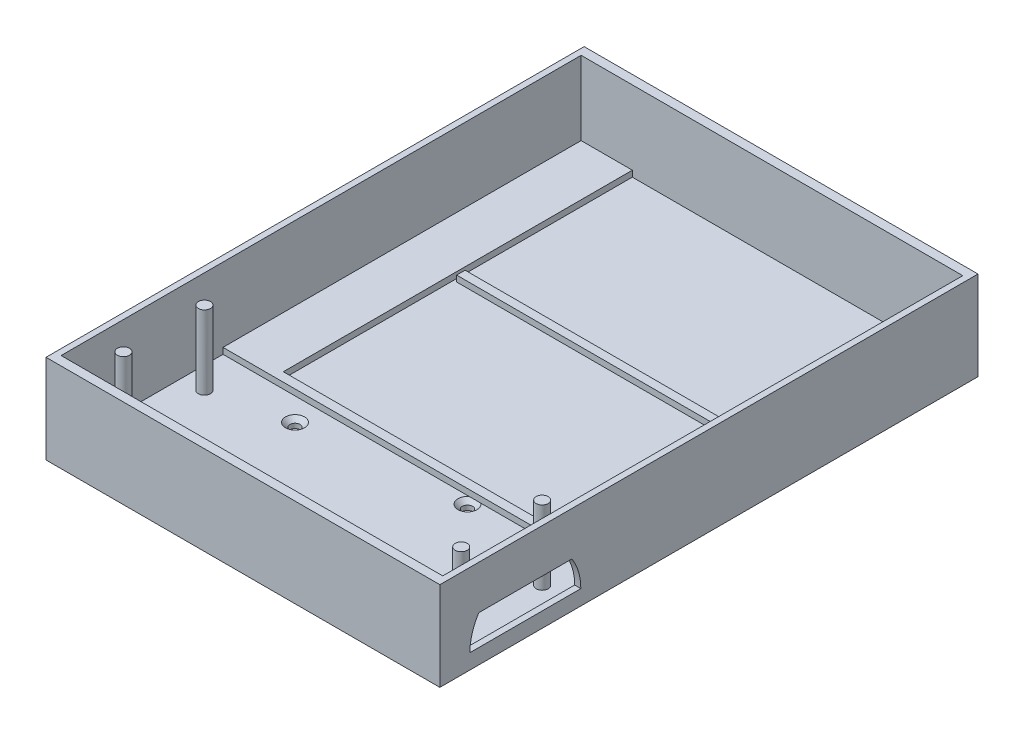
from build123d import *

# Parameters (mm, degrees)
SKETCH1_W                                    = 130.62
SKETCH1_H                                    = 3
SKETCH1_W_2                                  = 18.99
SKETCH1_W_3                                  = 25.43
SKETCH1_W_4                                  = 84.2
SKETCH1_H_2                                  = 2.79860344
BOSS_EXTRUDE1_DEPTH                          = 2
SKETCH2_W                                    = 130.62
SKETCH2_H                                    = 178.45860344
BOSS_EXTRUDE2_DEPTH                          = 3
CSK_FOR_M3_COUNTERSUNK_FLAT_HEAD_SCR_2_COUNT = 2
CSK_FOR_M3_COUNTERSUNK_FLAT_HEAD_SCR_2_PITCH = 53.025276991
CSK_FOR_M3_COUNTERSUNK_FLAT_HEAD_SCR_3_COUNT = 2
CSK_FOR_M3_COUNTERSUNK_FLAT_HEAD_SCR_3_PITCH = 66.620192134
CSK_FOR_M3_COUNTERSUNK_FLAT_HEAD_SCR_4_COUNT = 2
CSK_FOR_M3_COUNTERSUNK_FLAT_HEAD_SCR_4_PITCH = 48.217527933
SKETCH9_W                                    = 2.047760895
SKETCH9_H                                    = 53.7
SKETCH9_W_2                                  = 2
BOSS_EXTRUDE3_DEPTH                          = 24
SKETCH10_W                                   = 130.62
SKETCH10_H                                   = 3
BOSS_EXTRUDE4_DEPTH                          = 22
CUT_EXTRUDE1_DEPTH                           = 22
BOSS_EXTRUDE5_DEPTH                          = 22
SKETCH13_R                                   = 2
BOSS_EXTRUDE6_DEPTH                          = 24.5
SKETCH15_W                                   = 126.572239105
SKETCH15_H                                   = 3
SKETCH15_W_2                                 = 2
SKETCH15_H_2                                 = 172.45860344
SKETCH15_W_3                                 = 2.047760895
BOSS_EXTRUDE7_DEPTH                          = 2.5


with BuildPart() as part:
    # Sketch1 → Boss-Extrude1 (new body)
    with BuildSketch(Plane(origin=(0, 0, 0), x_dir=(1, 0, 0), z_dir=(0, 1, 0))):
        with Locations((69.266788991, -134.782980897)):
            Rectangle(SKETCH1_W, SKETCH1_H)
        with Locations((69.266788991, -78.082980897)):
            Rectangle(SKETCH1_W, SKETCH1_H)
        Polygon((134.576788991, -20.082980897), (109.146788991, -20.082980897), (109.146788991, -67.500327372), (109.146788991, -76.582980897), (134.576788991, -76.582980897), align=None)
        Polygon((22.946788991, -33.891997438), (22.946788991, -20.082980897), (3.956788991, -20.082980897), (3.956788991, -76.582980897), (22.946788991, -76.582980897), align=None)
        Polygon((22.946788991, -17.082980897), (22.946788991, 39.175622543), (6.956788991, 39.175622543), (3.956788991, 39.175622543), (3.956788991, -17.082980897), align=None)
        Polygon((131.576788991, 39.175622543), (109.146788991, 39.175622543), (109.146788991, -17.082980897), (134.576788991, -17.082980897), (134.576788991, 39.175622543), align=None)
        with Locations((13.451788991, -18.582980897)):
            Rectangle(SKETCH1_W_2, SKETCH1_H)
        with Locations((121.861788991, -18.582980897)):
            Rectangle(SKETCH1_W_3, SKETCH1_H)
        with Locations((66.046788991, -18.683679177)):
            Rectangle(SKETCH1_W_4, SKETCH1_H_2)
        Polygon((23.946788991, 39.175622543), (108.146788991, 39.175622543), (109.146788991, 39.175622543), (131.576788991, 39.175622543), (134.576788991, 39.175622543), (134.576788991, 42.175622543), (3.956788991, 42.175622543), (3.956788991, 39.175622543), (6.956788991, 39.175622543), (22.946788991, 39.175622543), align=None)
    extrude(amount=BOSS_EXTRUDE1_DEPTH)

    # Sketch2 → Boss-Extrude2 (add)
    with BuildSketch(Plane.XZ):
        with Locations((69.266788991, 47.053679177)):
            Rectangle(SKETCH2_W, SKETCH2_H)
    extrude(amount=BOSS_EXTRUDE2_DEPTH)

    # Sketch8 → CSK for M3 Countersunk Flat Head Screw1 (revolve, cut)
    with BuildSketch(Plane(origin=(88.234088991, 0, 130.282980897), x_dir=(0, 0, 1), z_dir=(1, 0, 0))):
        Polygon((0, 0), (0, 3), (1.7, 3), (1.7, 1.45), (3.15, 0), align=None)
    csk_for_m3_countersunk_flat_head_screw1 = revolve(axis=Axis((88.234088991, 6.35, 130.282980897), (0, -1, 0)), mode=Mode.SUBTRACT)

    # CSK for M3 Countersunk Flat Head Scr 2: CSK for M3 Countersunk Flat Head Screw1 ×2
    with Locations(*[Vector(-0.958033656445997, 0, -0.2866557397239995) * (i * CSK_FOR_M3_COUNTERSUNK_FLAT_HEAD_SCR_2_PITCH) for i in range(1, CSK_FOR_M3_COUNTERSUNK_FLAT_HEAD_SCR_2_COUNT)]):
        add(csk_for_m3_countersunk_flat_head_screw1, mode=Mode.SUBTRACT)

    # CSK for M3 Countersunk Flat Head Scr 3: CSK for M3 Countersunk Flat Head Screw1 ×2
    with Locations(*[Vector(-0.762531574476027, 0, -0.6469510011794644) * (i * CSK_FOR_M3_COUNTERSUNK_FLAT_HEAD_SCR_3_PITCH) for i in range(1, CSK_FOR_M3_COUNTERSUNK_FLAT_HEAD_SCR_3_COUNT)]):
        add(csk_for_m3_countersunk_flat_head_screw1, mode=Mode.SUBTRACT)

    # CSK for M3 Countersunk Flat Head Scr 4: CSK for M3 Countersunk Flat Head Screw1 ×2
    with Locations(*[Vector(0.02696114993281913, 0, -0.9996364821245272) * (i * CSK_FOR_M3_COUNTERSUNK_FLAT_HEAD_SCR_4_PITCH) for i in range(1, CSK_FOR_M3_COUNTERSUNK_FLAT_HEAD_SCR_4_COUNT)]):
        add(csk_for_m3_countersunk_flat_head_screw1, mode=Mode.SUBTRACT)

    # Sketch9 → Boss-Extrude3 (add)
    with BuildSketch(Plane(origin=(0, 0, 0), x_dir=(1, 0, 0), z_dir=(0, 1, 0))):
        with Locations((133.552908543, -106.432980897)):
            Rectangle(SKETCH9_W, SKETCH9_H)
        with Locations((4.956788991, -106.432980897)):
            Rectangle(SKETCH9_W_2, SKETCH9_H)
    extrude(amount=BOSS_EXTRUDE3_DEPTH)

    # Sketch10 → Boss-Extrude4 (add)
    with BuildSketch(Plane(origin=(0, 2, 0), x_dir=(1, 0, 0), z_dir=(0, 1, 0))):
        with Locations((69.266788991, -134.782980897)):
            Rectangle(SKETCH10_W, SKETCH10_H)
    extrude(amount=BOSS_EXTRUDE4_DEPTH)

    # Sketch11 → Cut-Extrude1 (cut)
    with BuildSketch(Plane(origin=(134.576788991, 0, 0), x_dir=(0, 0, -1), z_dir=(1, 0, 0))):
        with BuildLine():
            Line((-126.332980897, 2), (-107.932980897, 2))
            Line((-107.932980897, 2), (-107.932980897, 12))
            Line((-107.932980897, 12), (-123.378368558, 12))
            ThreePointArc((-123.378368558, 12), (-125.578874654, 7.213677543), (-126.332980897, 2))
        make_face()
        with BuildLine():
            Line((-107.932980897, 2), (-89.532980897, 2))
            ThreePointArc((-89.532980897, 2), (-90.28708714, 7.213677543), (-92.487593236, 12))
            Line((-92.487593236, 12), (-107.932980897, 12))
            Line((-107.932980897, 12), (-107.932980897, 2))
        make_face()
    extrude(amount=-CUT_EXTRUDE1_DEPTH, mode=Mode.SUBTRACT)

    # Sketch12 → Boss-Extrude5 (add)
    with BuildSketch(Plane(origin=(0, 2, 0), x_dir=(1, 0, 0), z_dir=(0, 1, 0))):
        Polygon((134.576788991, 42.175622543), (3.956788991, 42.175622543), (3.956788991, -79.582980897), (5.956788991, -79.582980897), (5.956788991, 39.175622543), (132.529028096, 39.175622543), (132.529028096, -79.582980897), (134.576788991, -79.582980897), align=None)
    extrude(amount=BOSS_EXTRUDE5_DEPTH)

    # Sketch13 → Boss-Extrude6 (add)
    with BuildSketch(Plane(origin=(0, 0, 0), x_dir=(1, 0, 0), z_dir=(0, 1, 0))):
        with BuildLine():
            Line((125.229028096, -117.857980897), (125.229028096, -119.857980897))
            Line((125.229028096, -119.857980897), (125.229028096, -121.857980897))
            ThreePointArc((125.229028096, -121.857980897), (126.643241659, -121.272194459), (127.229028096, -119.857980897))
            ThreePointArc((127.229028096, -119.857980897), (126.643241659, -118.443767335), (125.229028096, -117.857980897))
        make_face()
        with BuildLine():
            ThreePointArc((125.229028096, -117.857980897), (123.814814534, -118.443767335), (123.229028096, -119.857980897))
            Line((123.229028096, -119.857980897), (125.229028096, -119.857980897))
            Line((125.229028096, -119.857980897), (125.229028096, -117.857980897))
        make_face()
        with BuildLine():
            Line((125.229028096, -119.857980897), (123.229028096, -119.857980897))
            ThreePointArc((123.229028096, -119.857980897), (123.814814534, -121.272194459), (125.229028096, -121.857980897))
            Line((125.229028096, -121.857980897), (125.229028096, -119.857980897))
        make_face()
        with BuildLine():
            ThreePointArc((125.229028096, -117.857980897), (123.814814534, -118.443767335), (123.229028096, -119.857980897))
            Line((123.229028096, -119.857980897), (125.229028096, -119.857980897))
            Line((125.229028096, -119.857980897), (125.229028096, -117.857980897))
        make_face()
        with BuildLine():
            ThreePointArc((13.209288991, -121.857980897), (14.623502553, -121.272194459), (15.209288991, -119.857980897))
            Line((15.209288991, -119.857980897), (13.209288991, -119.857980897))
            Line((13.209288991, -119.857980897), (13.209288991, -121.857980897))
        make_face()
        with BuildLine():
            Line((13.209288991, -119.857980897), (15.209288991, -119.857980897))
            ThreePointArc((15.209288991, -119.857980897), (14.623502553, -118.443767335), (13.209288991, -117.857980897))
            Line((13.209288991, -117.857980897), (13.209288991, -119.857980897))
        make_face()
        with BuildLine():
            Line((13.209288991, -119.857980897), (15.209288991, -119.857980897))
            ThreePointArc((15.209288991, -119.857980897), (14.623502553, -118.443767335), (13.209288991, -117.857980897))
            Line((13.209288991, -117.857980897), (13.209288991, -119.857980897))
        make_face()
        with BuildLine():
            Line((13.209288991, -119.857980897), (13.209288991, -117.857980897))
            ThreePointArc((13.209288991, -117.857980897), (11.209288991, -119.857980897), (13.209288991, -121.857980897))
            Line((13.209288991, -121.857980897), (13.209288991, -119.857980897))
        make_face()
        with BuildLine():
            ThreePointArc((15.209288991, -93.007980897), (14.623502553, -91.593767335), (13.209288991, -91.007980897))
            Line((13.209288991, -91.007980897), (13.209288991, -93.007980897))
            Line((13.209288991, -93.007980897), (15.209288991, -93.007980897))
        make_face()
        with BuildLine():
            ThreePointArc((13.209288991, -95.007980897), (14.623502553, -94.422194459), (15.209288991, -93.007980897))
            Line((15.209288991, -93.007980897), (13.209288991, -93.007980897))
            Line((13.209288991, -93.007980897), (13.209288991, -95.007980897))
        make_face()
        with BuildLine():
            ThreePointArc((15.209288991, -93.007980897), (14.623502553, -91.593767335), (13.209288991, -91.007980897))
            Line((13.209288991, -91.007980897), (13.209288991, -93.007980897))
            Line((13.209288991, -93.007980897), (15.209288991, -93.007980897))
        make_face()
        with BuildLine():
            ThreePointArc((13.209288991, -95.007980897), (14.623502553, -94.422194459), (15.209288991, -93.007980897))
            Line((15.209288991, -93.007980897), (13.209288991, -93.007980897))
            Line((13.209288991, -93.007980897), (13.209288991, -95.007980897))
        make_face()
        with BuildLine():
            Line((13.209288991, -93.007980897), (13.209288991, -91.007980897))
            ThreePointArc((13.209288991, -91.007980897), (11.209288991, -93.007980897), (13.209288991, -95.007980897))
            Line((13.209288991, -95.007980897), (13.209288991, -93.007980897))
        make_face()
        with Locations(Location((125.229028096, -93.007980897, 0), (0, 0, 90))):
            Circle(SKETCH13_R)
    extrude(amount=BOSS_EXTRUDE6_DEPTH)

    # Sketch15 → Boss-Extrude7 (add)
    with BuildSketch(Plane(origin=(0, 24, 0), x_dir=(1, 0, 0), z_dir=(0, 1, 0))):
        with Locations((69.242908544, 40.675622543)):
            Rectangle(SKETCH15_W, SKETCH15_H)
        with Locations((4.956788991, -47.053679177)):
            Rectangle(SKETCH15_W_2, SKETCH15_H_2)
        with Locations((4.956788991, 40.675622543)):
            Rectangle(SKETCH15_W_2, SKETCH15_H)
        with Locations((133.552908543, 40.675622543)):
            Rectangle(SKETCH15_W_3, SKETCH15_H)
        Polygon((134.576788991, -136.282980897), (134.576788991, 39.175622543), (132.529028096, 39.175622543), (132.529028096, -133.282980897), (132.529028096, -136.282980897), align=None)
        with Locations((4.956788991, -134.782980897)):
            Rectangle(SKETCH15_W_2, SKETCH15_H)
        with Locations((69.242908544, -134.782980897)):
            Rectangle(SKETCH15_W, SKETCH15_H)
    extrude(amount=BOSS_EXTRUDE7_DEPTH)


solid = part.part
